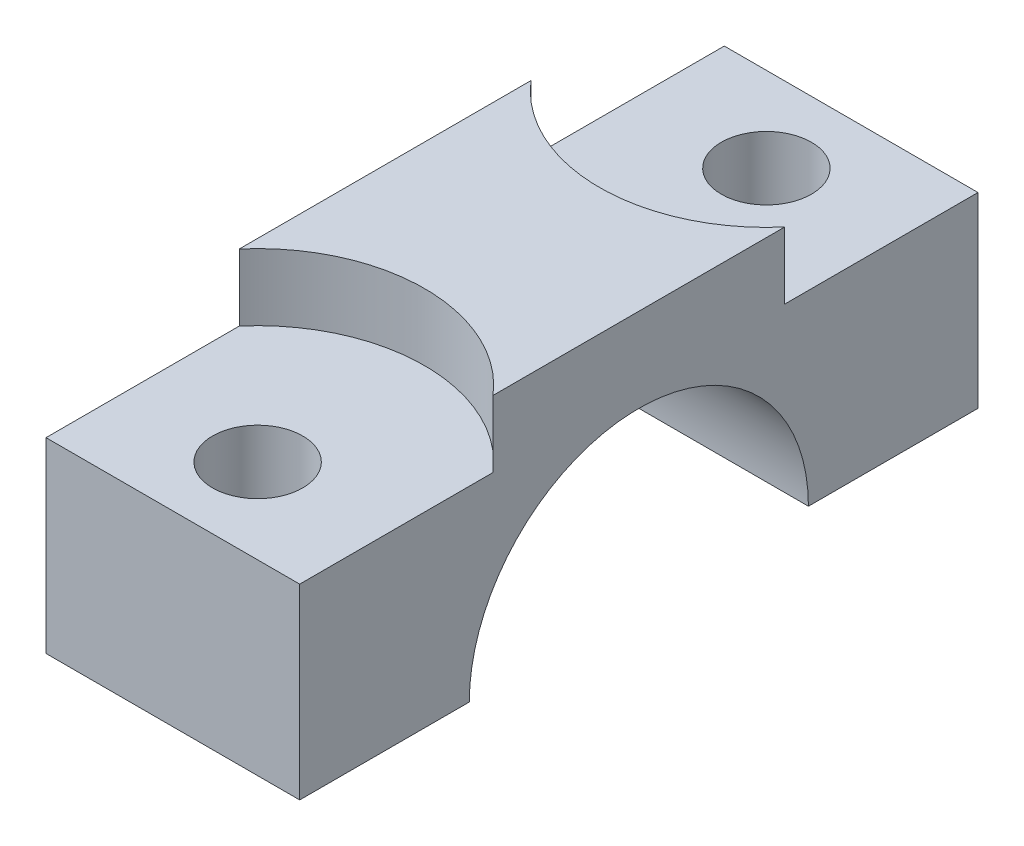
from build123d import *

# Parameters (mm, degrees)
BOSS_EXTRUDE1_DEPTH                           = 9.5
CBORE_FOR_M12_HEX_HEAD_CAP_SCREW1_D           = 6.75
CBORE_FOR_M12_HEX_HEAD_CAP_SCREW1_CBORE_D     = 25
CBORE_FOR_M12_HEX_HEAD_CAP_SCREW1_CBORE_DEPTH = 5


with BuildPart() as part:
    # Sketch1 → Boss-Extrude1 (new, symmetric)
    with BuildSketch(Plane(origin=(0, 0, 0), x_dir=(0, 0, -1), z_dir=(1, 0, 0))):
        with BuildLine():
            Line((12.7, 0), (25.4, 0))
            Line((25.4, 0), (25.4, 19))
            Line((25.4, 19), (-25.4, 19))
            Line((-25.4, 19), (-25.4, 0))
            Line((-25.4, 0), (-12.7, 0))
            ThreePointArc((-12.7, 0), (0, 12.7), (12.7, 0))
        make_face()
    extrude(amount=BOSS_EXTRUDE1_DEPTH, both=True)

    # CBORE for M12 Hex Head Cap Screw1 (through all)
    with Locations(Plane(origin=(0, 19, 0), x_dir=(1, 0, 0), z_dir=(0, 1, 0))):
        with Locations((0, 19.05), (0, -19.05)):
            CounterBoreHole(CBORE_FOR_M12_HEX_HEAD_CAP_SCREW1_D / 2, CBORE_FOR_M12_HEX_HEAD_CAP_SCREW1_CBORE_D / 2, CBORE_FOR_M12_HEX_HEAD_CAP_SCREW1_CBORE_DEPTH)


solid = part.part
